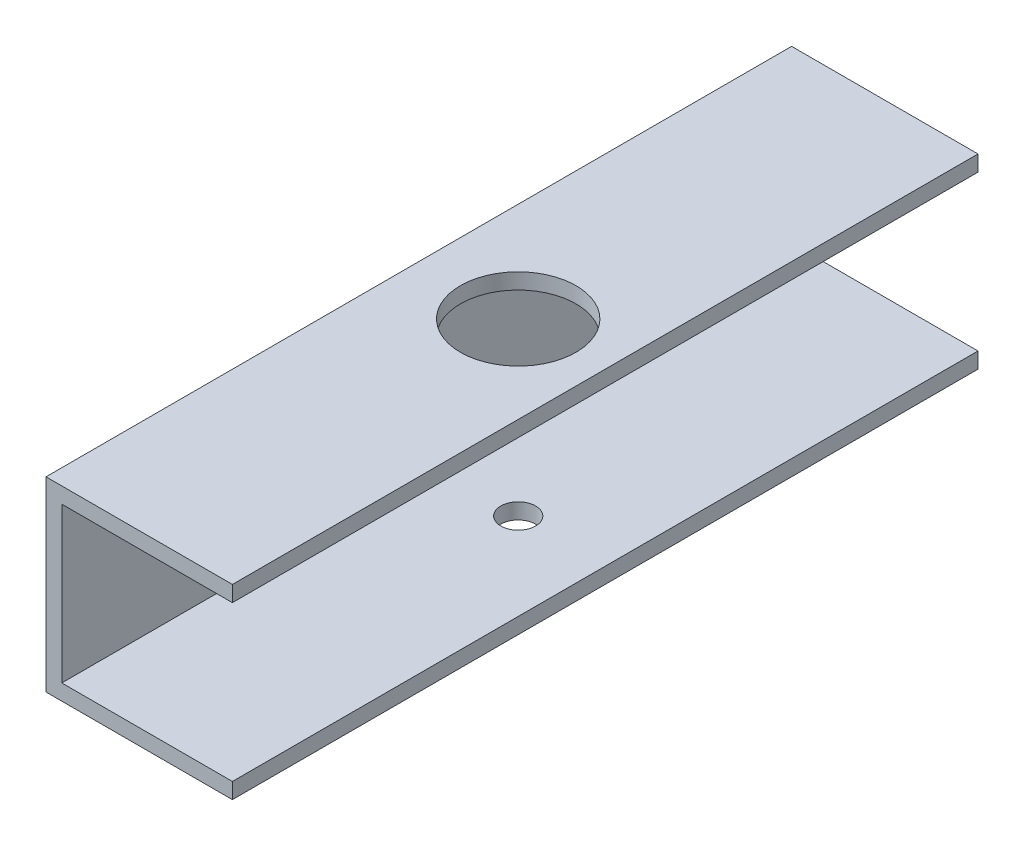
from build123d import *

# Parameters (mm, degrees)
BOSS_EXTRUDE1_DEPTH = 300
SKETCH2_R           = 23.25
CUT_EXTRUDE1_DEPTH  = 10
SKETCH3_R           = 7
CUT_EXTRUDE2_DEPTH  = 10


with BuildPart() as part:
    # Sketch1 → Boss-Extrude1 (new body)
    with BuildSketch(Plane.XY):
        Polygon((0, -37.5), (0, 37.5), (75, 37.5), (75, 31.15), (6.35, 31.15), (6.35, -31.15), (75, -31.15), (75, -37.5), align=None)
    extrude(amount=BOSS_EXTRUDE1_DEPTH)

    # Sketch2 → Cut-Extrude1 (cut)
    with BuildSketch(Plane(origin=(0, 37.5, 0), x_dir=(1, 0, 0), z_dir=(0, 1, 0))):
        with Locations(Location((40, -150, 0), (0, 0, 270))):
            Circle(SKETCH2_R)
    extrude(amount=-CUT_EXTRUDE1_DEPTH, mode=Mode.SUBTRACT)

    # Sketch3 → Cut-Extrude2 (cut)
    with BuildSketch(Plane.XZ.offset(37.5)):
        with Locations(Location((40, 150, 0), (0, 0, 270))):
            Circle(SKETCH3_R)
    extrude(amount=-CUT_EXTRUDE2_DEPTH, mode=Mode.SUBTRACT)


solid = part.part
